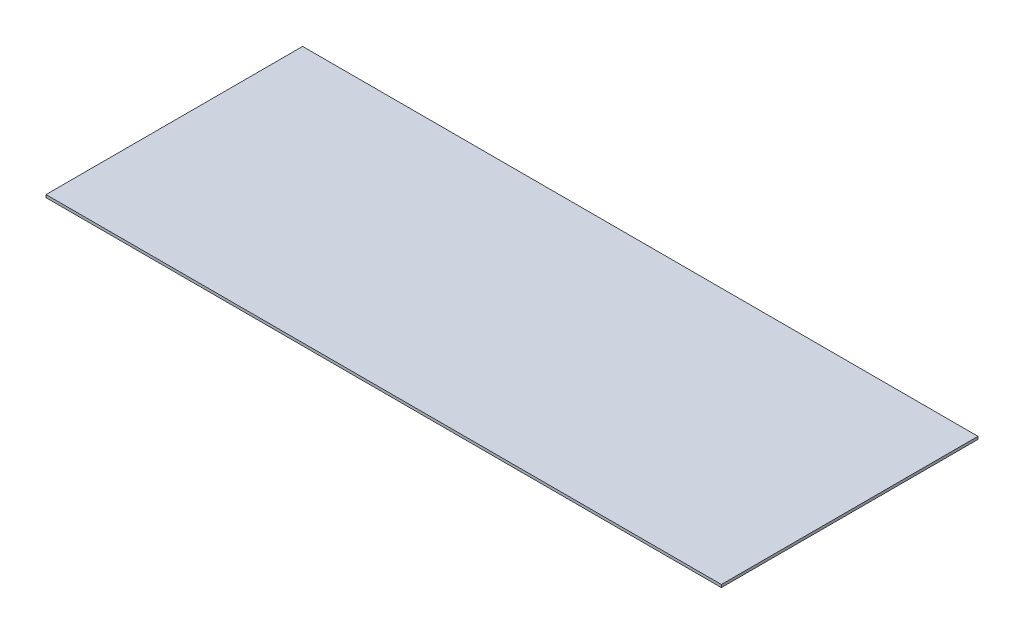
from build123d import *

# Parameters (mm, degrees)
SKETCH1_W           = 500
SKETCH1_H           = 190
BOSS_EXTRUDE1_DEPTH = 2


with BuildPart() as part:
    # Sketch1 → Boss-Extrude1 (new body)
    with BuildSketch(Plane(origin=(0, 0, 0), x_dir=(1, 0, 0), z_dir=(0, 1, 0))):
        with Locations((73.487712665, 24.092627599)):
            Rectangle(SKETCH1_W, SKETCH1_H)
    extrude(amount=BOSS_EXTRUDE1_DEPTH)


solid = part.part
